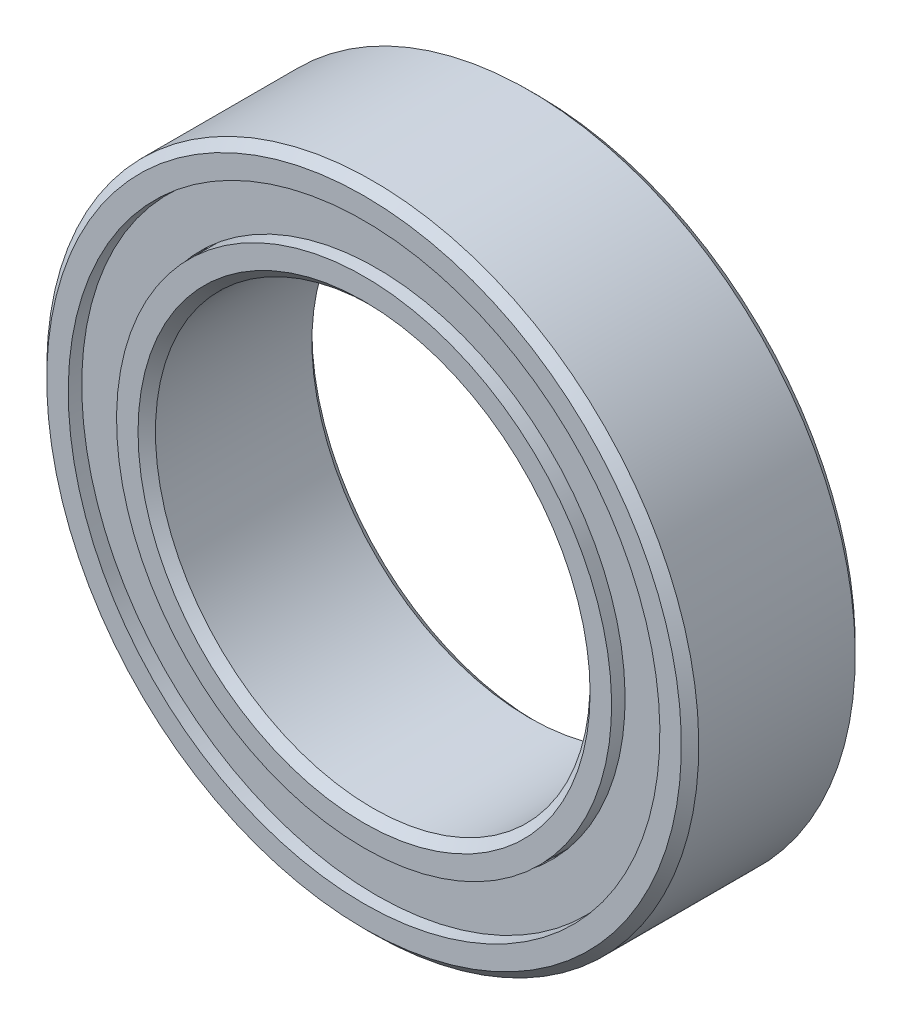
from build123d import *

# Parameters (mm, degrees)
SKETCH5_W         = 0.381
SKETCH5_H         = 1.060311112
CIRPATTERN1_COUNT = 11


with BuildPart() as part:
    # Sketch5 → Revolve1 (revolve)
    with BuildSketch(Plane(origin=(0, 0, 0), x_dir=(0, 0, -1), z_dir=(1, 0, 0)), mode=Mode.PRIVATE) as revolve1_sk:
        with BuildLine():
            Line((1.8, 7.5), (-1.8, 7.5))
            Line((-1.8, 7.5), (-2, 7.3))
            Line((-2, 7.3), (-2, 6.805555556))
            Line((-2, 6.805555556), (-0.888888889, 6.805555556))
            ThreePointArc((-0.888888889, 6.805555556), (0, 7.298220126), (0.888888889, 6.805555556))
            Line((0.888888889, 6.805555556), (2, 6.805555556))
            Line((2, 6.805555556), (2, 7.3))
            Line((2, 7.3), (1.8, 7.5))
        make_face()
        with Locations((1.524110063, 6.25)):
            Rectangle(SKETCH5_W, SKETCH5_H)
        with Locations((-1.524110063, 6.25)):
            Rectangle(SKETCH5_W, SKETCH5_H)
    revolve(revolve1_sk.sketch.rotate(Axis((0, 0, 2), (0, 0, -1)), 180), axis=Axis((0, 0, 2), (0, 0, -1)))


with BuildPart() as body_2:
    # Sketch3 → Revolve3 (revolve)
    with BuildSketch(Plane(origin=(0, 0, 0), x_dir=(0, 0, -1), z_dir=(1, 0, 0)), mode=Mode.PRIVATE) as revolve3_sk:
        with BuildLine():
            Line((-2, 5.694444444), (-0.888888889, 5.694444444))
            ThreePointArc((-0.888888889, 5.694444444), (0, 5.201779874), (0.888888889, 5.694444444))
            Line((0.888888889, 5.694444444), (2, 5.694444444))
            Line((2, 5.694444444), (2, 5.2))
            Line((2, 5.2), (1.8, 5))
            Line((1.8, 5), (-1.8, 5))
            Line((-1.8, 5), (-2, 5.2))
            Line((-2, 5.2), (-2, 5.694444444))
        make_face()
    revolve(revolve3_sk.sketch.rotate(Axis((0, 0, 2), (0, 0, -1)), 180), axis=Axis((0, 0, 2), (0, 0, -1)))


with BuildPart() as body_3:
    # Sketch4 → Revolve4 (revolve)
    with BuildSketch(Plane(origin=(0, 0, 0), x_dir=(0, 0, -1), z_dir=(1, 0, 0))):
        with BuildLine():
            Line((-1.048220126, 6.25), (1.048220126, 6.25))
            ThreePointArc((1.048220126, 6.25), (0, 7.298220126), (-1.048220126, 6.25))
        make_face()
    revolve(axis=Axis((0, 6.25, 1.048220126), (0, 0, -1)))


with BuildPart() as cirpattern1_1:
    # CirPattern1: pattern copy
    add(body_3.part.rotate(Axis((0, 0, 0), (0, 0, 1)), 1 * 360 / CIRPATTERN1_COUNT))


with BuildPart() as cirpattern1_2:
    # CirPattern1: pattern copy
    add(body_3.part.rotate(Axis((0, 0, 0), (0, 0, 1)), 2 * 360 / CIRPATTERN1_COUNT))


with BuildPart() as cirpattern1_3:
    # CirPattern1: pattern copy
    add(body_3.part.rotate(Axis((0, 0, 0), (0, 0, 1)), 3 * 360 / CIRPATTERN1_COUNT))


with BuildPart() as cirpattern1_4:
    # CirPattern1: pattern copy
    add(body_3.part.rotate(Axis((0, 0, 0), (0, 0, 1)), 4 * 360 / CIRPATTERN1_COUNT))


with BuildPart() as cirpattern1_5:
    # CirPattern1: pattern copy
    add(body_3.part.rotate(Axis((0, 0, 0), (0, 0, 1)), 5 * 360 / CIRPATTERN1_COUNT))


with BuildPart() as cirpattern1_6:
    # CirPattern1: pattern copy
    add(body_3.part.rotate(Axis((0, 0, 0), (0, 0, 1)), 6 * 360 / CIRPATTERN1_COUNT))


with BuildPart() as cirpattern1_7:
    # CirPattern1: pattern copy
    add(body_3.part.rotate(Axis((0, 0, 0), (0, 0, 1)), 7 * 360 / CIRPATTERN1_COUNT))


with BuildPart() as cirpattern1_8:
    # CirPattern1: pattern copy
    add(body_3.part.rotate(Axis((0, 0, 0), (0, 0, 1)), 8 * 360 / CIRPATTERN1_COUNT))


with BuildPart() as cirpattern1_9:
    # CirPattern1: pattern copy
    add(body_3.part.rotate(Axis((0, 0, 0), (0, 0, 1)), 9 * 360 / CIRPATTERN1_COUNT))


with BuildPart() as cirpattern1_10:
    # CirPattern1: pattern copy
    add(body_3.part.rotate(Axis((0, 0, 0), (0, 0, 1)), 10 * 360 / CIRPATTERN1_COUNT))


solid = Compound([part.part, body_2.part, body_3.part, cirpattern1_1.part, cirpattern1_2.part, cirpattern1_3.part, cirpattern1_4.part, cirpattern1_5.part, cirpattern1_6.part, cirpattern1_7.part, cirpattern1_8.part, cirpattern1_9.part, cirpattern1_10.part])
